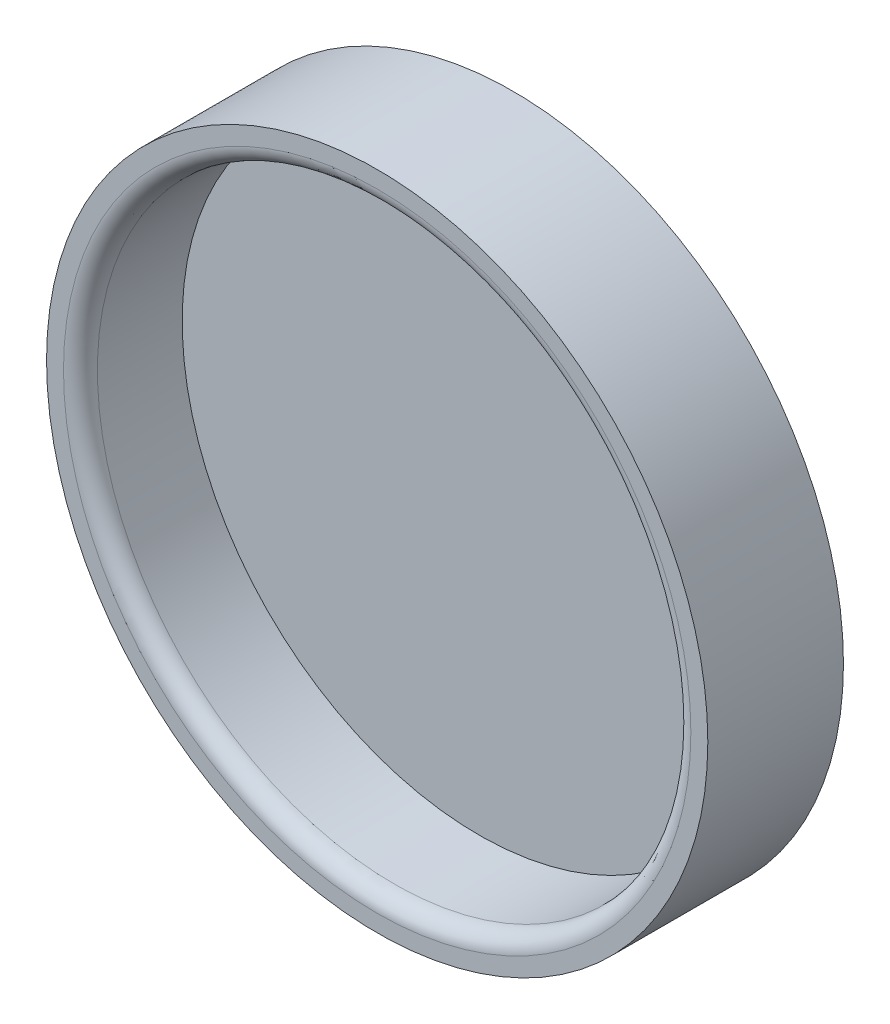
from build123d import *

# Parameters (mm, degrees)
SKETCH1_R           = 9.75
BOSS_EXTRUDE1_DEPTH = 1
SKETCH2_R           = 9.75
SKETCH2_R_2         = 8.75
BOSS_EXTRUDE2_DEPTH = 3
FILLET1_R           = 0.5


with BuildPart() as part:
    # Sketch1 → Boss-Extrude1 (new body)
    with BuildSketch(Plane.XY):
        Circle(SKETCH1_R)
    extrude(amount=BOSS_EXTRUDE1_DEPTH)

    # Sketch2 → Boss-Extrude2 (add)
    with BuildSketch(Plane.XY.offset(1)):
        Circle(SKETCH2_R)
        Circle(SKETCH2_R_2, mode=Mode.SUBTRACT)
    extrude(amount=BOSS_EXTRUDE2_DEPTH)

    # Fillet1
    fillet1_edges = [part.edges().sort_by_distance(p)[0] for p in [
        (-8.75, 0, 4),
    ]]
    fillet(fillet1_edges, radius=FILLET1_R)


solid = part.part
